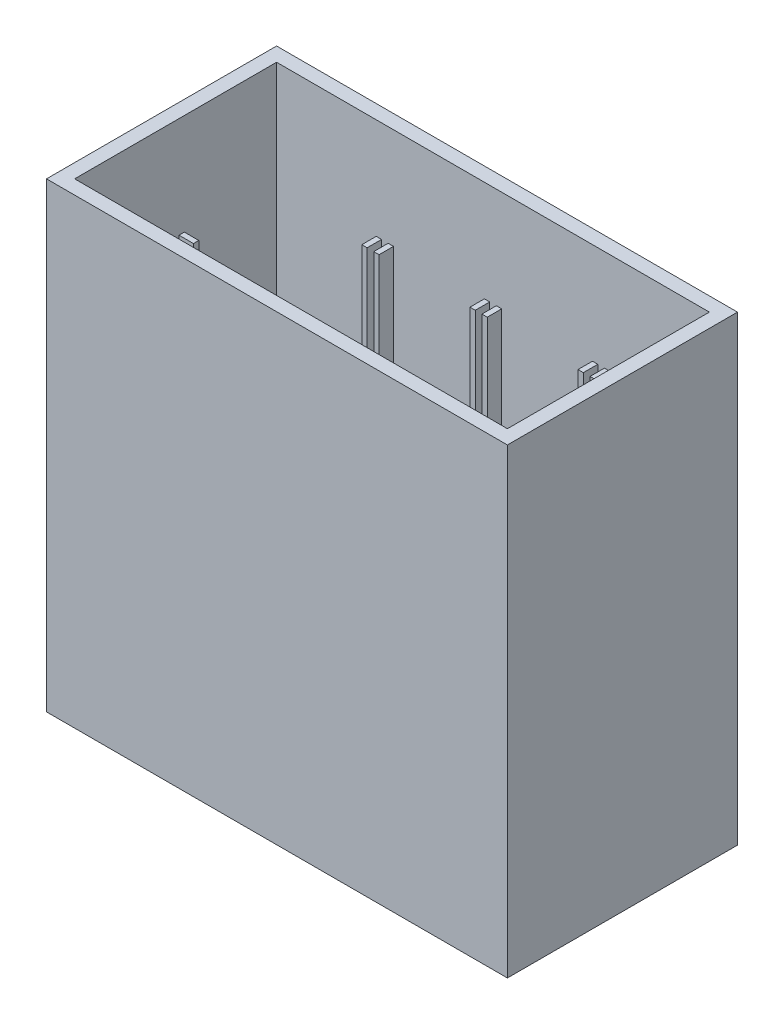
from build123d import *

# Parameters (mm, degrees)
SKETCH1_W           = 159.75
SKETCH1_H           = 79.75
BOSS_EXTRUDE1_DEPTH = 225
SKETCH2_W           = 150
SKETCH2_H           = 70
CUT_EXTRUDE1_DEPTH  = 220
SKETCH7_W           = 1.875
SKETCH7_H           = 120
BOSS_EXTRUDE2_DEPTH = 5
SKETCH8_W           = 1.85
SKETCH8_H           = 120
BOSS_EXTRUDE3_DEPTH = 5
SKETCH9_W           = 1.85
SKETCH9_H           = 120
BOSS_EXTRUDE4_DEPTH = 5
SKETCH10_W          = 1.85
SKETCH10_H          = 120
BOSS_EXTRUDE5_DEPTH = 5
SKETCH11_W          = 159.75
SKETCH11_H          = 79.75
SKETCH11_W_2        = 150
SKETCH11_H_2        = 70
CUT_EXTRUDE2_DEPTH  = 65


with BuildPart() as part:
    # Sketch1 → Boss-Extrude1 (new body)
    with BuildSketch(Plane(origin=(0, 0, 0), x_dir=(1, 0, 0), z_dir=(0, 1, 0))):
        Rectangle(SKETCH1_W, SKETCH1_H)
    extrude(amount=BOSS_EXTRUDE1_DEPTH)

    # Sketch2 → Cut-Extrude1 (cut)
    with BuildSketch(Plane(origin=(0, 225, 0), x_dir=(1, 0, 0), z_dir=(0, 1, 0))):
        Rectangle(SKETCH2_W, SKETCH2_H)
    extrude(amount=-CUT_EXTRUDE1_DEPTH, mode=Mode.SUBTRACT)

    # Sketch7 → Boss-Extrude2 (add)
    with BuildSketch(Plane(origin=(0, 0, 35), x_dir=(-1, 0, 0), z_dir=(0, 0, -1))):
        with Locations((-39.5375, 65)):
            Rectangle(SKETCH7_W, SKETCH7_H)
        with Locations((-35.4125, 65)):
            Rectangle(SKETCH7_W, SKETCH7_H)
        with Locations((-2.0375, 65)):
            Rectangle(SKETCH7_W, SKETCH7_H)
        with Locations((2.0875, 65)):
            Rectangle(SKETCH7_W, SKETCH7_H)
        with Locations((35.4125, 65)):
            Rectangle(SKETCH7_W, SKETCH7_H)
        with Locations((39.5375, 65)):
            Rectangle(SKETCH7_W, SKETCH7_H)
    extrude(amount=BOSS_EXTRUDE2_DEPTH)

    # Sketch8 → Boss-Extrude3 (add)
    with BuildSketch(Plane.XY.offset(-35)):
        with Locations((-39.55, 65)):
            Rectangle(SKETCH8_W, SKETCH8_H)
        with Locations((-35.4, 65)):
            Rectangle(SKETCH8_W, SKETCH8_H)
        with Locations((-2.05, 65)):
            Rectangle(SKETCH8_W, SKETCH8_H)
        with Locations((2.1, 65)):
            Rectangle(SKETCH8_W, SKETCH8_H)
        with Locations((35.4, 65)):
            Rectangle(SKETCH8_W, SKETCH8_H)
        with Locations((39.55, 65)):
            Rectangle(SKETCH8_W, SKETCH8_H)
    extrude(amount=BOSS_EXTRUDE3_DEPTH)

    # Sketch9 → Boss-Extrude4 (add)
    with BuildSketch(Plane(origin=(-75, 0, 0), x_dir=(0, 0, -1), z_dir=(1, 0, 0))):
        with Locations((-2.05, 65)):
            Rectangle(SKETCH9_W, SKETCH9_H)
        with Locations((2.1, 65)):
            Rectangle(SKETCH9_W, SKETCH9_H)
    extrude(amount=BOSS_EXTRUDE4_DEPTH)

    # Sketch10 → Boss-Extrude5 (add)
    with BuildSketch(Plane.ZY.offset(-75)):
        with Locations((-2.05, 65)):
            Rectangle(SKETCH10_W, SKETCH10_H)
        with Locations((2.1, 65)):
            Rectangle(SKETCH10_W, SKETCH10_H)
    extrude(amount=BOSS_EXTRUDE5_DEPTH)

    # Sketch11 → Cut-Extrude2 (cut)
    with BuildSketch(Plane(origin=(0, 225, 0), x_dir=(1, 0, 0), z_dir=(0, 1, 0))):
        Rectangle(SKETCH11_W, SKETCH11_H)
        Rectangle(SKETCH11_W_2, SKETCH11_H_2, mode=Mode.SUBTRACT)
    extrude(amount=-CUT_EXTRUDE2_DEPTH, mode=Mode.SUBTRACT)


solid = part.part
